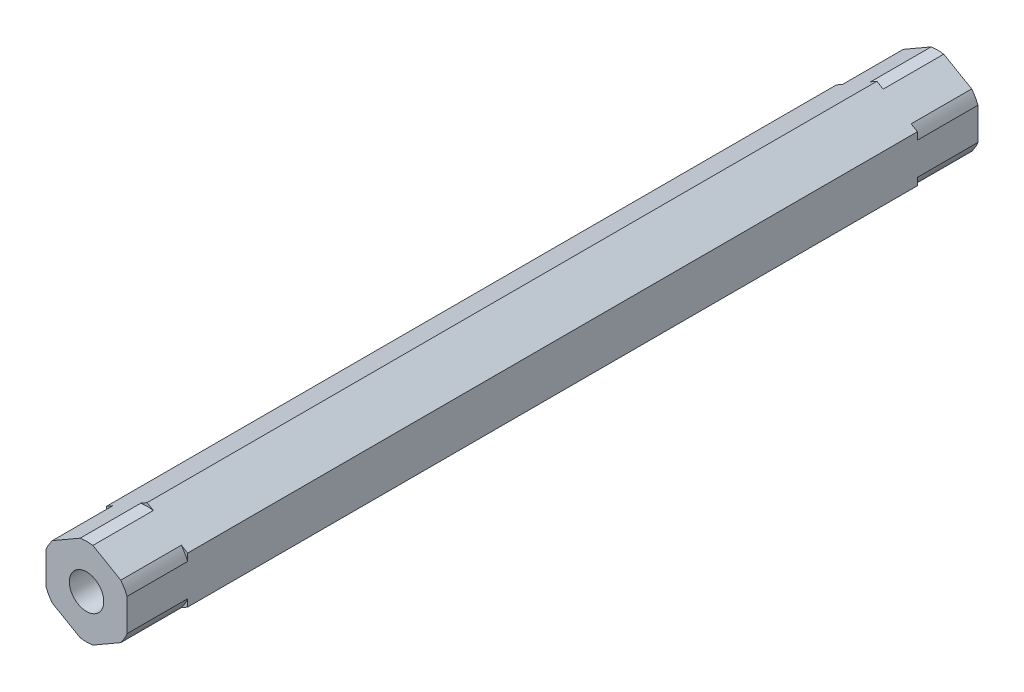
from build123d import *

# Parameters (mm, degrees)
BOSS_EXTRUDE1_DEPTH = 49.9745
SKETCH2_R           = 2.0193
CUT_EXTRUDE1_DEPTH  = 19.05
SKETCH3_R           = 11.064818238
SKETCH3_R_2         = 5.125
CUT_EXTRUDE2_DEPTH  = 7.112


with BuildPart() as part:
    # Sketch1 → Boss-Extrude1 (new, symmetric)
    with BuildSketch(Plane.XY):
        Polygon((4.7625, 2.749630657), (0, 5.499261314), (-4.7625, 2.749630657), (-4.7625, -2.749630657), (0, -5.499261314), (4.7625, -2.749630657), align=None)
    extrude(amount=BOSS_EXTRUDE1_DEPTH, both=True)

    # Sketch2 → Cut-Extrude1 (cut)
    with BuildSketch(Plane(origin=(0, 0, -49.9745), x_dir=(-1, 0, 0), z_dir=(0, 0, -1))):
        Circle(SKETCH2_R)
    cut_extrude1 = extrude(amount=-CUT_EXTRUDE1_DEPTH, mode=Mode.SUBTRACT)

    # Mirror1: Cut-Extrude1 across plane
    add(cut_extrude1.mirror(Plane.XY), mode=Mode.SUBTRACT)

    # Sketch3 → Cut-Extrude2 (cut)
    with BuildSketch(Plane(origin=(0, 0, -49.9745), x_dir=(-1, 0, 0), z_dir=(0, 0, -1))):
        Circle(SKETCH3_R)
        Circle(SKETCH3_R_2, mode=Mode.SUBTRACT)
    cut_extrude2 = extrude(amount=-CUT_EXTRUDE2_DEPTH, mode=Mode.SUBTRACT)

    # Mirror2: Cut-Extrude2 across plane
    add(cut_extrude2.mirror(Plane.XY), mode=Mode.SUBTRACT)


solid = part.part
